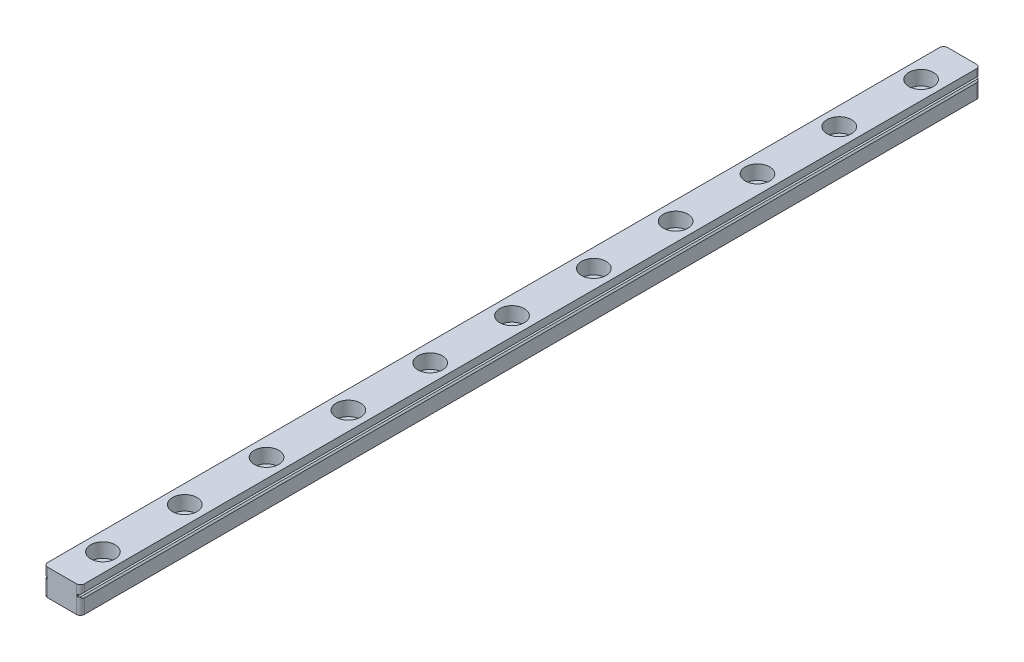
from build123d import *

# Parameters (mm, degrees)
EXTRUDE_1_DEPTH        = 220
SKETCH_2_R             = 3
CUT_EXTRUDE_1_DEPTH    = 3.5
SKETCH_3_R             = 1.75
CUT_EXTRUDE_2_DEPTH    = 221.073851241
PATTERN_LINEAR_1_COUNT = 30
PATTERN_LINEAR_1_PITCH = 20
FILLET_1_R             = 1


with BuildPart() as part:
    # 草图1 → 凸台-拉伸1 (new body)
    with BuildSketch(Plane.XY):
        Polygon((-4.5, -3.663424778), (4.5, -3.663424778), (4.5, -0.163424778), (4.146446609, 0.190128613), (3.646446609, 0.190128613), (3.646446609, 0.690128613), (4.146446609, 0.690128613), (4.5, 1.043682003), (4.5, 2.836575222), (-4.5, 2.836575222), (-4.5, 1.043682003), (-4.146446609, 0.690128613), (-3.646446609, 0.690128613), (-3.646446609, 0.190128613), (-4.146446609, 0.190128613), (-4.5, -0.163424778), align=None)
    extrude(amount=EXTRUDE_1_DEPTH)

    # 草图2 → 切除-拉伸1 (cut)
    with BuildSketch(Plane(origin=(0, 2.836575222, 0), x_dir=(1, 0, 0), z_dir=(0, 1, 0))):
        with Locations(Location((0, -210, 0), (0, 0, 270))):
            Circle(SKETCH_2_R)
    cut_extrude_1 = extrude(amount=-CUT_EXTRUDE_1_DEPTH, mode=Mode.SUBTRACT)

    # 草图3 → 切除-拉伸2 (cut, through all)
    with BuildSketch(Plane(origin=(0, -0.663424778, 0), x_dir=(1, 0, 0), z_dir=(0, 1, 0))):
        with Locations(Location((0, -210, 0), (0, 0, 270))):
            Circle(SKETCH_3_R)
    cut_extrude_2 = extrude(amount=-CUT_EXTRUDE_2_DEPTH, mode=Mode.SUBTRACT)

    # 阵列(线性)1: 切除-拉伸1, 切除-拉伸2 ×30
    with Locations(*[(0, 0, -i * PATTERN_LINEAR_1_PITCH) for i in range(1, PATTERN_LINEAR_1_COUNT)]):
        add(cut_extrude_1, mode=Mode.SUBTRACT)
        add(cut_extrude_2, mode=Mode.SUBTRACT)

    # 圆角1
    fillet_1_edges = [part.edges().sort_by_distance(p)[0] for p in [
        (4.5, -1.913424778, 0),
        (-4.5, -1.913424778, 0),
        (4.5, -1.913424778, 220),
        (-4.5, -1.913424778, 220),
    ]]
    fillet(fillet_1_edges, radius=FILLET_1_R)


solid = part.part
